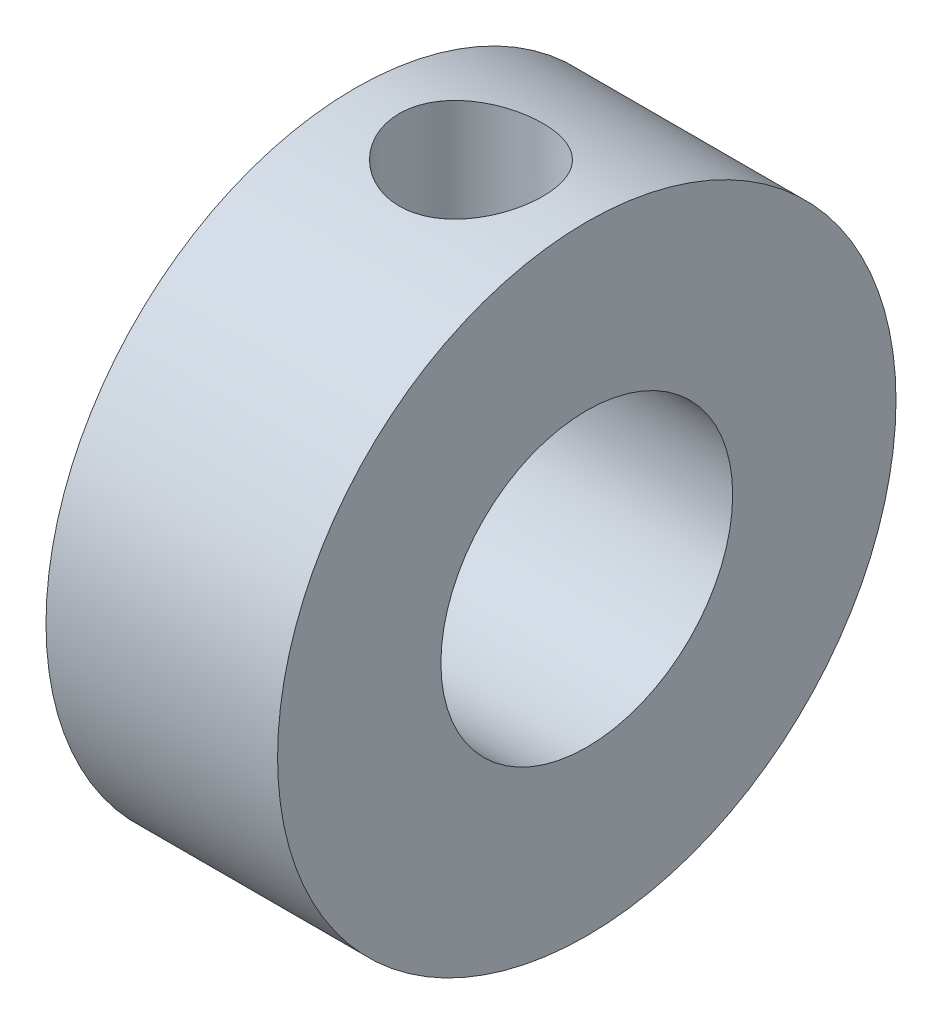
from build123d import *

# Parameters (mm, degrees)
SKETCH1_W   = 12.7
SKETCH1_H   = 8.957130771
HOLE2_D     = 7.874
HOLE2_DEPTH = 17.78


with BuildPart() as part:
    # Sketch1 → Revolve1 (revolve)
    with BuildSketch(Plane.XY, mode=Mode.PRIVATE) as revolve1_sk:
        with Locations((6.35, 12.479565386)):
            Rectangle(SKETCH1_W, SKETCH1_H)
    revolve(revolve1_sk.sketch.rotate(Axis((0, 0, 0), (1, 0, 0)), 90), axis=Axis((0, 0, 0), (1, 0, 0)))

    # Hole2
    with Locations(Plane(origin=(6.35, 16.958130771, 0), x_dir=(0, 0, 1), z_dir=(0, 1, 0))):
        with Locations((0, 0)):
            Hole(HOLE2_D / 2, depth=HOLE2_DEPTH)


solid = part.part
